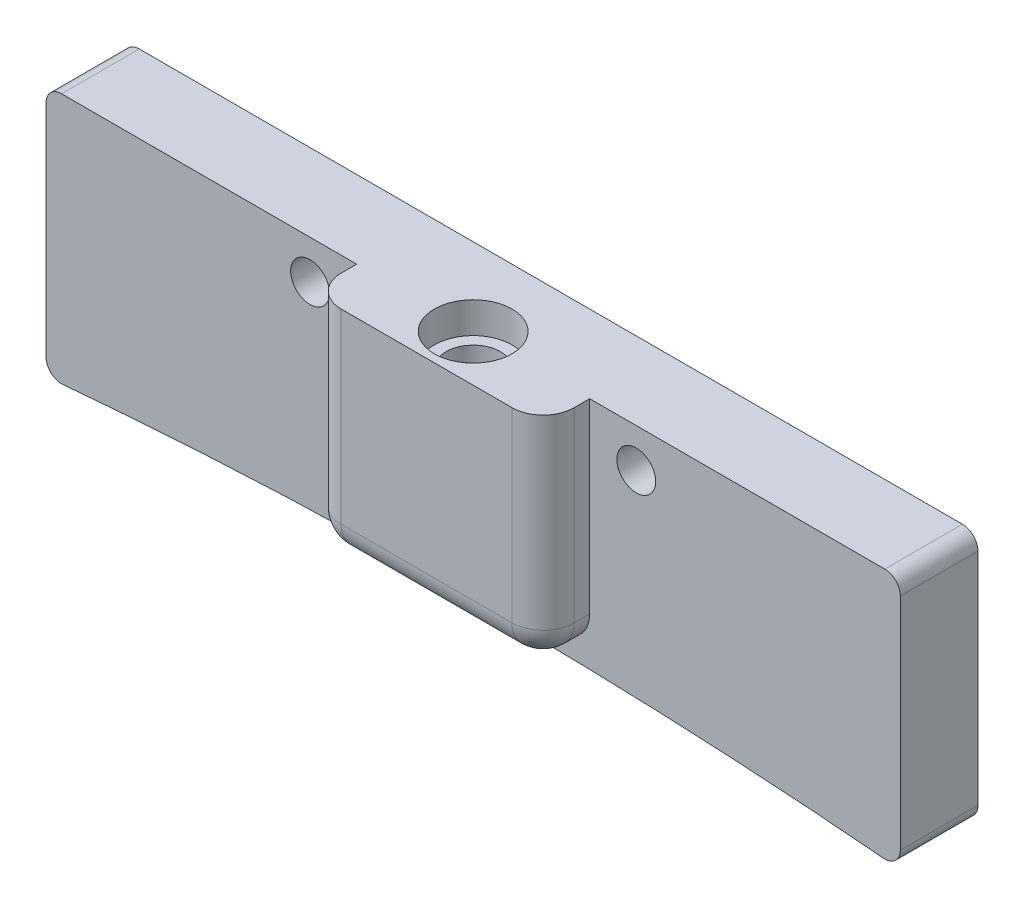
from build123d import *

# Parameters (mm, degrees)
BOSS_EXTRUDE1_DEPTH                     = 5
SKETCH4_W                               = 15
SKETCH4_H                               = 14
BOSS_EXTRUDE2_DEPTH                     = 3
CBORE_FOR_M6_HEX_HEAD_BOLT1_D           = 3.5
CBORE_FOR_M6_HEX_HEAD_BOLT1_DEPTH       = 10
CBORE_FOR_M6_HEX_HEAD_BOLT1_CBORE_D     = 5
CBORE_FOR_M6_HEX_HEAD_BOLT1_CBORE_DEPTH = 2
CBORE_FOR_M6_HEX_HEAD_BOLT1_TIP         = 1.75
FILLET1_R                               = 1
FILLET2_R                               = 2
M3X0_5_TAPPED_HOLE1_D                   = 2.5
M3X0_5_TAPPED_HOLE1_DEPTH               = 5
M3X0_5_TAPPED_HOLE1_TIP                 = 0.751075774


with BuildPart() as part:
    # Sketch1 → Boss-Extrude1 (new body)
    with BuildSketch(Plane(origin=(0, 0, 0), x_dir=(-1, 0, 0), z_dir=(0, 0, -1))):
        with BuildLine():
            Line((27.500000074, -16.263075607), (27.500000074, 0))
            Line((27.500000074, 0), (-27.5, 0))
            Line((-27.5, 0), (-27.5, -16.2630756))
            ThreePointArc((-27.5, -16.2630756), (3.7e-08, -15), (27.500000074, -16.263075607))
        make_face()
    extrude(amount=-BOSS_EXTRUDE1_DEPTH)

    # Sketch4 → Boss-Extrude2 (add)
    with BuildSketch(Plane.XY.offset(5)):
        with Locations((0, -7)):
            Rectangle(SKETCH4_W, SKETCH4_H)
    extrude(amount=BOSS_EXTRUDE2_DEPTH)

    # CBORE for M6 Hex Head Bolt1
    with Locations(Plane(origin=(0, 0, 0), x_dir=(1, 0, 0), z_dir=(0, 1, 0))):
        with Locations((0, -5)):
            CounterBoreHole(CBORE_FOR_M6_HEX_HEAD_BOLT1_D / 2, CBORE_FOR_M6_HEX_HEAD_BOLT1_CBORE_D / 2, CBORE_FOR_M6_HEX_HEAD_BOLT1_CBORE_DEPTH, depth=CBORE_FOR_M6_HEX_HEAD_BOLT1_DEPTH)
            with Locations((0, 0, -(CBORE_FOR_M6_HEX_HEAD_BOLT1_DEPTH + CBORE_FOR_M6_HEX_HEAD_BOLT1_TIP / 2))):  # 90° drill point
                Cone(0, CBORE_FOR_M6_HEX_HEAD_BOLT1_D / 2, CBORE_FOR_M6_HEX_HEAD_BOLT1_TIP, mode=Mode.SUBTRACT)

    # Fillet1
    fillet1_edges = [part.edges().sort_by_distance(p)[0] for p in [
        (27.5, 0, 2.5),
        (-27.500000074, 0, 2.5),
        (27.5, -16.2630756, 2.5),
        (-27.500000074, -16.263075607, 2.5),
    ]]
    fillet(fillet1_edges, radius=FILLET1_R)

    # Fillet2
    fillet2_edges = [part.edges().sort_by_distance(p)[0] for p in [
        (7.5, -14, 6.5),
        (7.5, -7, 8),
        (-7.5, -14, 6.5),
        (0, -14, 8),
        (-7.5, -7, 8),
    ]]
    fillet(fillet2_edges, radius=FILLET2_R)

    # M3x0.5 Tapped Hole1
    with Locations(Plane(origin=(-10.5, -2.5, 5), x_dir=(1, 0, 0), z_dir=(0, 0, 1))):
        with Locations((0, 0), (21, 0)):
            Hole(M3X0_5_TAPPED_HOLE1_D / 2, depth=M3X0_5_TAPPED_HOLE1_DEPTH)
            with Locations((0, 0, -(M3X0_5_TAPPED_HOLE1_DEPTH + M3X0_5_TAPPED_HOLE1_TIP / 2))):  # 118° drill point
                Cone(0, M3X0_5_TAPPED_HOLE1_D / 2, M3X0_5_TAPPED_HOLE1_TIP, mode=Mode.SUBTRACT)


solid = part.part
